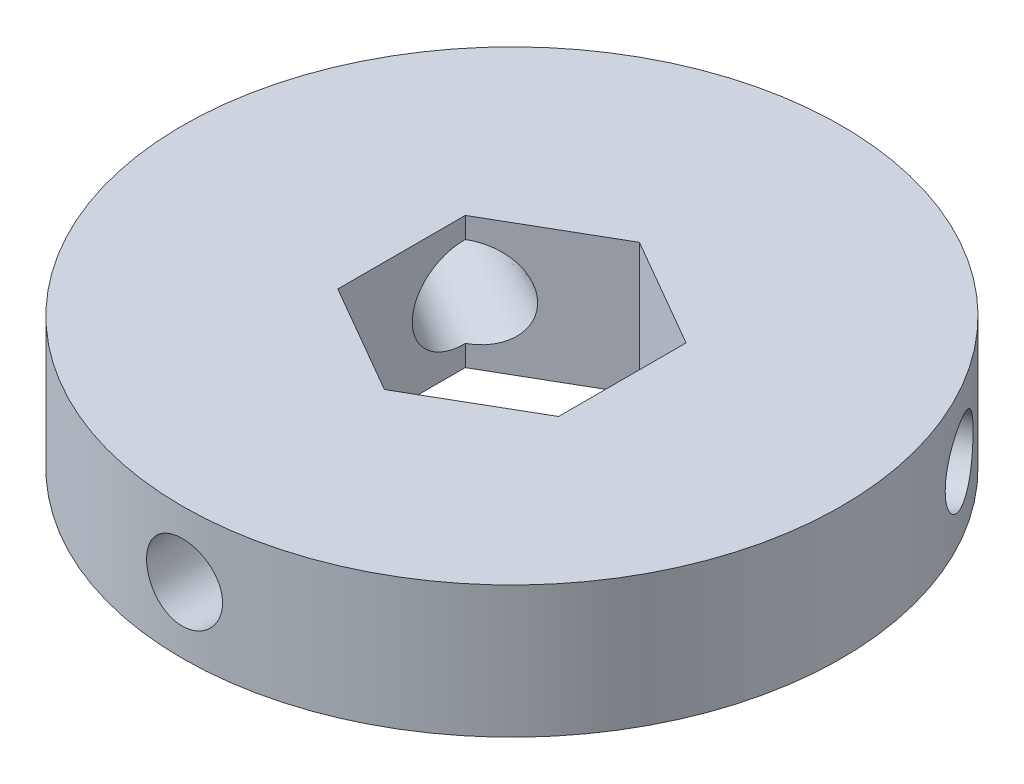
from build123d import *

# Parameters (mm, degrees)
SKETCH1_R               = 10
BOSS_EXTRUDE1_DEPTH     = 2
CUT_EXTRUDE1_REACH      = 16.283
CUT_EXTRUDE1_END_RADIUS = 10
SKETCH2_R               = 1.5
CUT_EXTRUDE1_DRAFT      = 2
CIRPATTERN1_COUNT       = 3


with BuildPart() as part:
    # Sketch1 → Boss-Extrude1 (new, symmetric)
    with BuildSketch(Plane(origin=(0, 0, 0), x_dir=(1, 0, 0), z_dir=(0, 1, 0))):
        with Locations(Location((0, 0, 0), (0, 0, 270))):
            Circle(SKETCH1_R)
        Polygon((0, 3.868246804), (-3.35, 1.934123402), (-3.35, -1.934123402), (0, -3.868246804), (3.35, -1.934123402), (3.35, 1.934123402), align=None, mode=Mode.SUBTRACT)
    extrude(amount=BOSS_EXTRUDE1_DEPTH, both=True)

    # Cut-Extrude1: up to this cylinder (the profile starts inside it)
    cut_extrude1_end = Plane(origin=(0, 0, 0), z_dir=(0, -1, 0)) * Cylinder(CUT_EXTRUDE1_END_RADIUS, 53.566, mode=Mode.PRIVATE)



with BuildPart() as cut_extrude1_long_prism_1:
    # Sketch2 → Cut-Extrude1 (the long prism of profile 1, to be tilted and cut off)
    with BuildSketch(Plane.XY):
        Circle(SKETCH2_R)
    extrude(amount=CUT_EXTRUDE1_REACH)
    cut_extrude1_tool1_sides = [cut_extrude1_long_prism_1.faces().sort_by_distance(p)[0] for p in [
        (-1.5, 0, 8.1415),
    ]]
    draft(cut_extrude1_tool1_sides, Plane.XY, CUT_EXTRUDE1_DRAFT)  # the draft: side faces tilted about the start plane


with BuildPart() as part_1:
    add(part.part)
    cut_extrude1_tool1 = cut_extrude1_long_prism_1.part & cut_extrude1_end
    cut_extrude1 = cut_extrude1_tool1.solids().sort_by_distance((0, 0, 0))[0]
    add(cut_extrude1, mode=Mode.SUBTRACT)

    # CirPattern1: Cut-Extrude1 ×3 about axis
    cirpattern1_axis = Axis((0, 2, 0), (0, -1, 0))
    for i in range(1, CIRPATTERN1_COUNT):
        add(cut_extrude1.rotate(cirpattern1_axis, i * 360 / CIRPATTERN1_COUNT), mode=Mode.SUBTRACT)


solid = part_1.part
